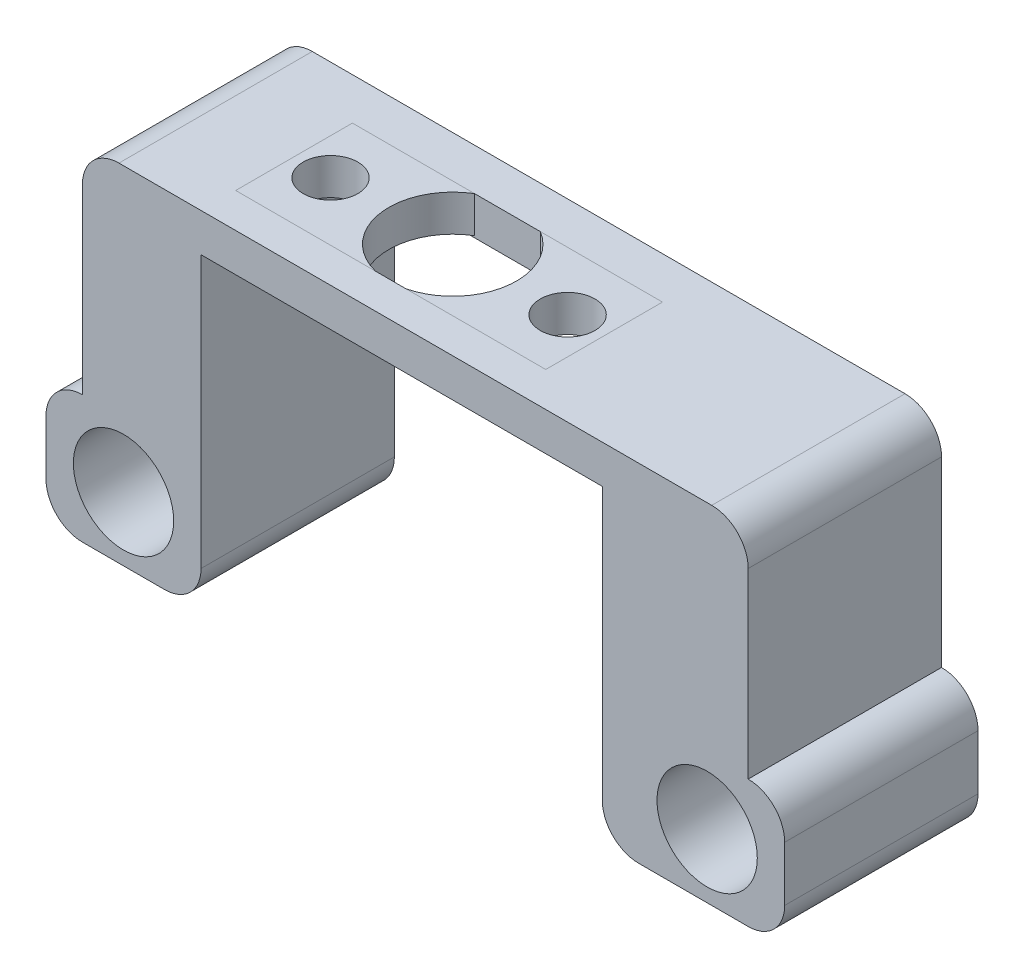
from build123d import *

# Parameters (mm, degrees)
CROQUIS1_W                = 40.5
CROQUIS1_H                = 7
CROQUIS1_R                = 2.75
SALIENTE_EXTRUIR1_DEPTH   = 10.6
CROQUIS5_R                = 3.4
CORTAR_EXTRUIR4_DEPTH     = 7
REDONDEO1_R               = 2
CROQUIS7_W                = 17
CROQUIS7_H                = 6.4
CORTAR_EXTRUIR5_DEPTH     = 5
CROQUIS8_R                = 1.5
CORTAR_EXTRUIR6_DEPTH     = 2
CROQUIS11_W               = 36.5
CROQUIS11_H               = 10.6
CROQUIS11_W_2             = 17
CROQUIS11_H_2             = 6.4
SALIENTE_EXTRUIR3_DEPTH   = 12
CROQUIS12_R               = 1.5
SALIENTE_EXTRUIR4_DEPTH   = 2
SALIENTE_EXTRUIR4_2_DEPTH = 2
CORTAR_EXTRUIR7_START     = -10.6
CORTAR_EXTRUIR7_DEPTH     = 10.6
REDONDEO2_R               = 2


with BuildPart() as part:
    # Croquis1 → Saliente-Extruir1 (new body)
    with BuildSketch(Plane.XY):
        with Locations((-26.183013117, -10.786568945)):
            Rectangle(CROQUIS1_W, CROQUIS1_H)
        with Locations((-42.183013117, -10.786568945)):
            Circle(CROQUIS1_R, mode=Mode.SUBTRACT)
        with Locations((-10.183013117, -10.786568945)):
            Circle(CROQUIS1_R, mode=Mode.SUBTRACT)
    extrude(amount=SALIENTE_EXTRUIR1_DEPTH)

    # Croquis5 → Cortar-Extruir4 (cut)
    with BuildSketch(Plane.XZ.offset(14.286568945)):
        with Locations(Location((-29.433013117, 5.3, 0), (0, 0, 270))):
            Circle(CROQUIS5_R)
    extrude(amount=-CORTAR_EXTRUIR4_DEPTH, mode=Mode.SUBTRACT)

    # Redondeo1
    redondeo1_edges = [part.edges().sort_by_distance(p)[0] for p in [
        (-46.433013117, -7.286568945, 5.3),
        (-5.933013117, -7.286568945, 5.3),
        (-5.933013117, -14.286568945, 5.3),
        (-46.433013117, -14.286568945, 5.3),
    ]]
    fillet(redondeo1_edges, radius=REDONDEO1_R)

    # Croquis7 → Cortar-Extruir5 (cut)
    with BuildSketch(Plane(origin=(0, -7.286568945, 0), x_dir=(1, 0, 0), z_dir=(0, 1, 0))):
        with Locations((-29.433013117, -5.5)):
            Rectangle(CROQUIS7_W, CROQUIS7_H)
    extrude(amount=-CORTAR_EXTRUIR5_DEPTH, mode=Mode.SUBTRACT)

    # Croquis8 → Cortar-Extruir6 (cut)
    with BuildSketch(Plane(origin=(0, -12.286568945, 0), x_dir=(1, 0, 0), z_dir=(0, 1, 0))):
        with Locations(Location((-22.933013117, -5.5, 0), (0, 0, 270))):
            Circle(CROQUIS8_R)
        with Locations(Location((-35.933013117, -5.5, 0), (0, 0, 270))):
            Circle(CROQUIS8_R)
    extrude(amount=-CORTAR_EXTRUIR6_DEPTH, mode=Mode.SUBTRACT)

    # Croquis11 → Saliente-Extruir3 (add)
    with BuildSketch(Plane(origin=(0, -7.286568945, 0), x_dir=(1, 0, 0), z_dir=(0, 1, 0))):
        with Locations((-26.183013117, -5.3)):
            Rectangle(CROQUIS11_W, CROQUIS11_H)
        with Locations((-29.433013117, -5.5)):
            Rectangle(CROQUIS11_W_2, CROQUIS11_H_2, mode=Mode.SUBTRACT)
    extrude(amount=SALIENTE_EXTRUIR3_DEPTH)

    # Croquis13 → Cortar-Extruir7 (cut)
    with BuildSketch(Plane(origin=(0, 0, 0), x_dir=(-1, 0, 0), z_dir=(0, 0, -1)).offset(CORTAR_EXTRUIR7_START)):
        Polygon((37.933013117, -14.286568945), (15.933013117, -14.286568945), (15.933013117, 2.613431055), (20.933013117, 2.613431055), (37.933013117, 2.613431055), align=None)
    extrude(amount=CORTAR_EXTRUIR7_DEPTH, mode=Mode.SUBTRACT)

    # Redondeo2
    redondeo2_edges = [part.edges().sort_by_distance(p)[0] for p in [
        (-37.933013117, -14.286568945, 5.3),
        (-15.933013117, -14.286568945, 5.3),
        (-44.433013117, 4.713431055, 5.3),
        (-7.933013117, 4.713431055, 5.3),
    ]]
    fillet(redondeo2_edges, radius=REDONDEO2_R)


with BuildPart() as body_2:
    # Croquis12 → Saliente-Extruir4 (new body)
    with BuildSketch(Plane(origin=(0, 4.713431055, 0), x_dir=(1, 0, 0), z_dir=(0, 1, 0))):
        with BuildLine():
            Line((-31.235788754, -2.3), (-37.933013117, -2.3))
            Line((-37.933013117, -2.3), (-37.933013117, -8.7))
            Line((-37.933013117, -8.7), (-30.263675503, -8.7))
            ThreePointArc((-30.263675503, -8.7), (-32.893323646, -5.825595894), (-31.235788754, -2.3))
        make_face()
        with Locations(Location((-35.933013117, -5.5, 0), (0, 0, 180))):
            Circle(CROQUIS12_R, mode=Mode.SUBTRACT)
    extrude(amount=-SALIENTE_EXTRUIR4_DEPTH)


with BuildPart() as body_3:
    # Croquis12 → Saliente-Extruir4 2 (new body)
    with BuildSketch(Plane(origin=(0, 4.713431055, 0), x_dir=(1, 0, 0), z_dir=(0, 1, 0))):
        with BuildLine():
            Line((-20.933013117, -2.3), (-27.630237479, -2.3))
            ThreePointArc((-27.630237479, -2.3), (-26.386727285, -3.576589824), (-25.933013117, -5.3))
            ThreePointArc((-25.933013117, -5.3), (-26.680076653, -7.461328486), (-28.60235073, -8.7))
            Line((-28.60235073, -8.7), (-20.933013117, -8.7))
            Line((-20.933013117, -8.7), (-20.933013117, -2.3))
        make_face()
        with Locations(Location((-22.933013117, -5.5, 0), (0, 0, 180))):
            Circle(CROQUIS12_R, mode=Mode.SUBTRACT)
    extrude(amount=-SALIENTE_EXTRUIR4_2_DEPTH)


solid = Compound([part.part, body_2.part, body_3.part])
